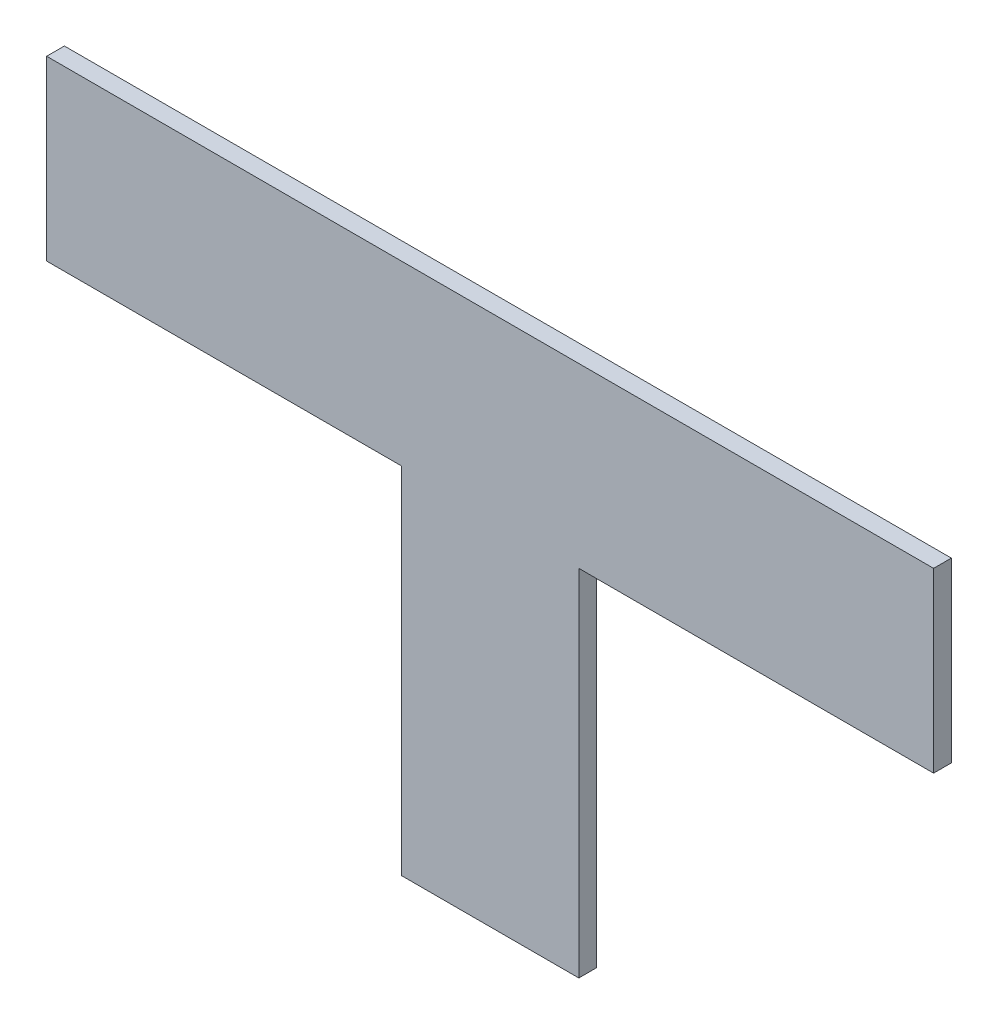
from build123d import *

# Parameters (mm, degrees)
SKETCH1_W           = 20
SKETCH1_H           = 40
BOSS_EXTRUDE1_DEPTH = 2


with BuildPart() as part:
    # Sketch1 → Boss-Extrude1 (new body)
    with BuildSketch(Plane.XY):
        Polygon((-50, 20), (-10, 20), (10, 20), (50, 20), (50, 40), (-50, 40), align=None)
        Rectangle(SKETCH1_W, SKETCH1_H)
    extrude(amount=BOSS_EXTRUDE1_DEPTH)


solid = part.part
